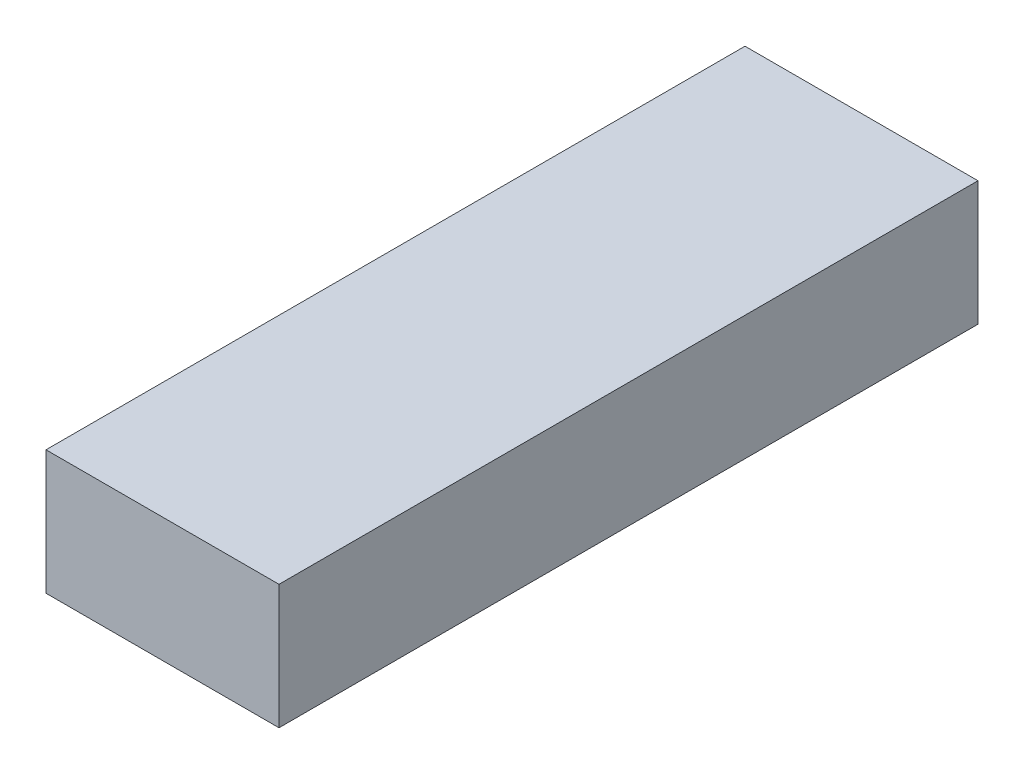
from build123d import *

# Parameters (mm, degrees)
SKETCH_1_W          = 60
SKETCH_1_H          = 32
EXTRUDE_1_DEPTH     = 180
SKETCH_2_W          = 56
SKETCH_2_H          = 26
CUT_EXTRUDE_1_DEPTH = 30


with BuildPart() as part:
    # 草图1 → 凸台-拉伸1 (new body)
    with BuildSketch(Plane.XY):
        with Locations((30, 16)):
            Rectangle(SKETCH_1_W, SKETCH_1_H)
    extrude(amount=EXTRUDE_1_DEPTH)

    # 草图2 → 切除-拉伸1 (cut)
    with BuildSketch(Plane(origin=(0, 0, 0), x_dir=(-1, 0, 0), z_dir=(0, -1, 0))):
        with Locations((-30, -165)):
            Rectangle(SKETCH_2_W, SKETCH_2_H)
        with Locations((-30, -135.5)):
            Rectangle(SKETCH_2_W, SKETCH_2_H)
        with Locations((-30, -106)):
            Rectangle(SKETCH_2_W, SKETCH_2_H)
        with Locations((-30, -76.5)):
            Rectangle(SKETCH_2_W, SKETCH_2_H)
        with Locations((-30, -47)):
            Rectangle(SKETCH_2_W, SKETCH_2_H)
        with Locations((-30, -17.5)):
            Rectangle(SKETCH_2_W, SKETCH_2_H)
    extrude(amount=-CUT_EXTRUDE_1_DEPTH, mode=Mode.SUBTRACT)


solid = part.part
